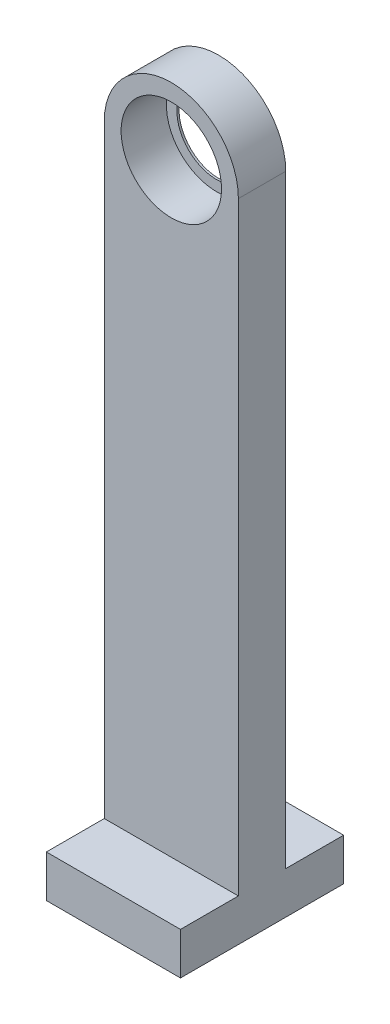
from build123d import *

# Parameters (mm, degrees)
SKETCH1_R                = 6.370055282
SKETCH1_R_2              = 4.77
BOSS_EXTRUDE1_DEPTH      = 4.5
BOSS_EXTRUDE2_DEPTH      = 4.5
BOSS_EXTRUDE3_DEPTH      = 10
BOSS_EXTRUDE3_DEPTH_BACK = 5.5
SKETCH4_W                = 12.740110564
SKETCH4_H                = 4
SKETCH6_R                = 4.77
SKETCH6_R_2              = 3.77
BOSS_EXTRUDE4_DEPTH      = 0.2


with BuildPart() as part:
    # Sketch1 → Boss-Extrude1 (new body)
    with BuildSketch(Plane.XY):
        Circle(SKETCH1_R)
        Circle(SKETCH1_R_2, mode=Mode.SUBTRACT)
    extrude(amount=BOSS_EXTRUDE1_DEPTH)

    # Sketch3 → Boss-Extrude2 (add)
    with BuildSketch(Plane.XY):
        with BuildLine():
            Line((6.370055282, 0), (6.370055282, -61.37))
            Line((6.370055282, -61.37), (-6.370055282, -61.37))
            Line((-6.370055282, -61.37), (-6.370055282, 0))
            ThreePointArc((-6.370055282, 0), (0, -6.370055282), (6.370055282, 0))
        make_face()
    extrude(amount=BOSS_EXTRUDE2_DEPTH)

    # Sketch4 → Boss-Extrude3 (add, two sides: drawn at the far end of the back side and taken through both)
    with BuildSketch(Plane.XY.offset(-BOSS_EXTRUDE3_DEPTH_BACK)):
        with Locations((0, -59.37)):
            Rectangle(SKETCH4_W, SKETCH4_H)
    extrude(amount=BOSS_EXTRUDE3_DEPTH + BOSS_EXTRUDE3_DEPTH_BACK)

    # Sketch6 → Boss-Extrude4 (add)
    with BuildSketch(Plane.XY):
        Circle(SKETCH6_R)
        Circle(SKETCH6_R_2, mode=Mode.SUBTRACT)
    extrude(amount=BOSS_EXTRUDE4_DEPTH)


solid = part.part
